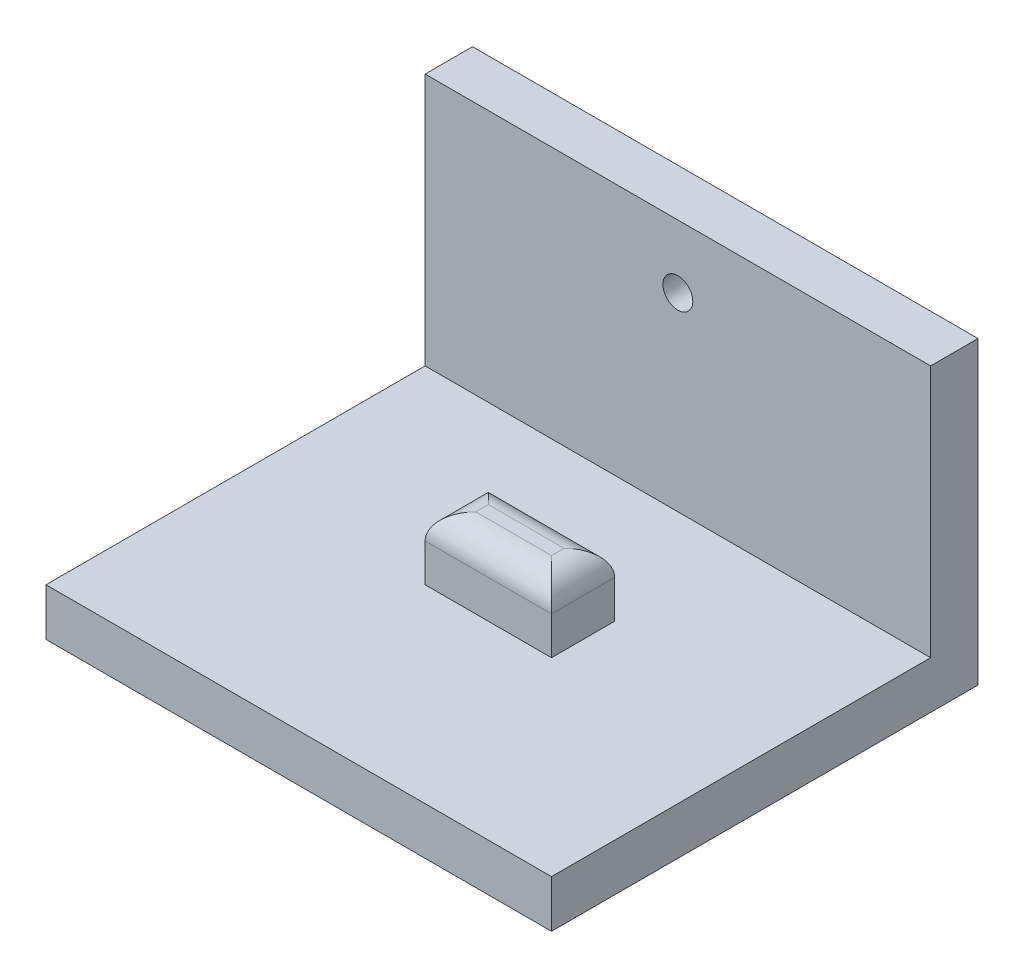
from build123d import *

# Parameters (mm, degrees)
BOSS_EXTRUDE1_DEPTH = 50.8
SKETCH2_W           = 12.7
SKETCH2_H           = 6.35
BOSS_EXTRUDE2_DEPTH = 6.35
SKETCH3_R           = 1.499997
CUT_EXTRUDE1_DEPTH  = 71.299547696
FILLET1_R           = 2.54


with BuildPart() as part:
    # Sketch1 → Boss-Extrude1 (new body)
    with BuildSketch(Plane(origin=(0, 0, 0), x_dir=(0, 0, -1), z_dir=(1, 0, 0))):
        Polygon((0, 0), (-42.8625, 0), (-42.8625, 4.7625), (-4.7625, 4.7625), (-4.7625, 30.1625), (0, 30.1625), align=None)
    extrude(amount=BOSS_EXTRUDE1_DEPTH)

    # Sketch2 → Boss-Extrude2 (add)
    with BuildSketch(Plane(origin=(0, 4.7625, 0), x_dir=(1, 0, 0), z_dir=(0, 1, 0))):
        with Locations((25.4, -20.6375)):
            Rectangle(SKETCH2_W, SKETCH2_H)
    extrude(amount=BOSS_EXTRUDE2_DEPTH)

    # Sketch3 → Cut-Extrude1 (cut, through all)
    with BuildSketch(Plane.XY.offset(4.7625)):
        with Locations((25.4, 23.8125)):
            Circle(SKETCH3_R)
    extrude(amount=-CUT_EXTRUDE1_DEPTH, mode=Mode.SUBTRACT)

    # Fillet1
    fillet1_edges = [part.edges().sort_by_distance(p)[0] for p in [
        (19.05, 11.1125, 20.6375),
        (25.4, 11.1125, 23.8125),
        (31.75, 11.1125, 20.6375),
        (25.4, 11.1125, 17.4625),
    ]]
    fillet(fillet1_edges, radius=FILLET1_R)


solid = part.part
